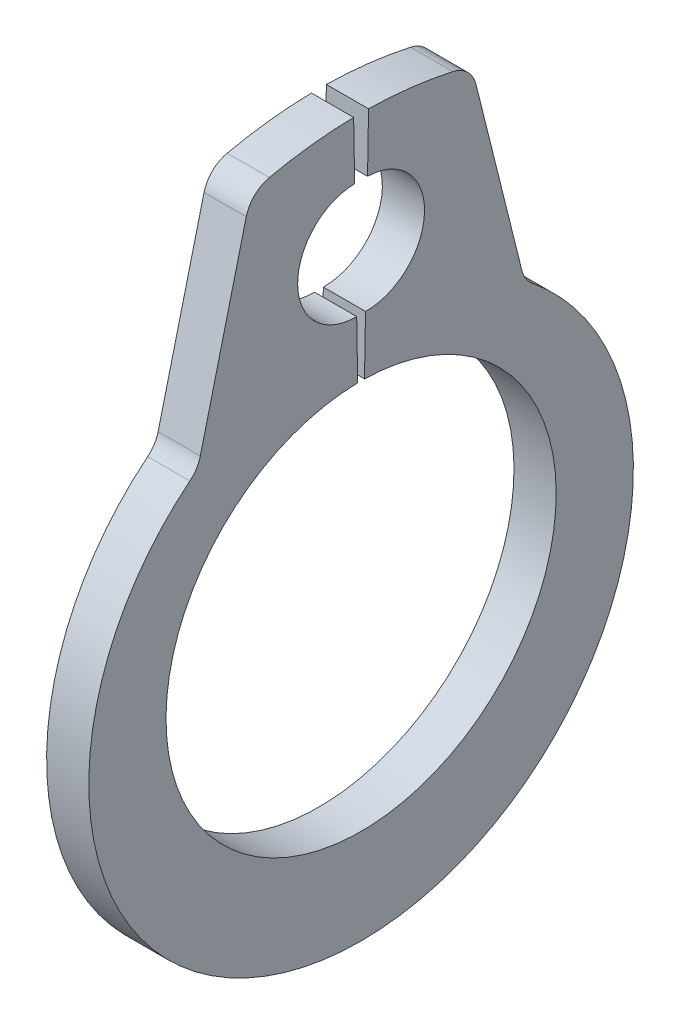
from build123d import *

# Parameters (mm, degrees)
EXTRUDE1_DEPTH = 0.2
FILLET1_R      = 0.29


with BuildPart() as part:
    # Sketch1 → Extrude1 (new, symmetric)
    with BuildSketch(Plane(origin=(0, 0, 0), x_dir=(0, 0, -1), z_dir=(1, 0, 0))):
        with BuildLine():
            Line((0.032286952, 1.849718236), (0.041885775, 2.399634468))
            ThreePointArc((0.041885775, 2.399634468), (0.601400831, 2.939951877), (0.061083423, 3.499466933))
            Line((0.061083423, 3.499466933), (0.070682246, 4.049383165))
            ThreePointArc((0.070682246, 4.049383165), (0.562907746, 4.010690074), (1.046766998, 3.912387871))
            Line((1.046766998, 3.912387871), (1.548955628, 1.898219287))
            ThreePointArc((1.548955628, 1.898219287), (0, -2.75), (-1.548955628, 1.898219287))
            Line((-1.548955628, 1.898219287), (-1.046766998, 3.912387871))
            ThreePointArc((-1.046766998, 3.912387871), (-0.562907746, 4.010690074), (-0.070682246, 4.049383165))
            Line((-0.070682246, 4.049383165), (-0.061083423, 3.499466933))
            ThreePointArc((-0.061083423, 3.499466933), (-0.601400831, 2.939951877), (-0.041885775, 2.399634468))
            Line((-0.041885775, 2.399634468), (-0.032286952, 1.849718236))
            ThreePointArc((-0.032286952, 1.849718236), (0, -1.85), (0.032286952, 1.849718236))
        make_face()
    extrude(amount=EXTRUDE1_DEPTH, both=True)

    # Fillet1
    fillet1_edges = [part.edges().sort_by_distance(p)[0] for p in [
        (0, 3.912387871, -1.046766998),
        (0, 1.898219287, -1.548955628),
        (0, 1.898219287, 1.548955628),
        (0, 3.912387871, 1.046766998),
    ]]
    fillet(fillet1_edges, radius=FILLET1_R)


solid = part.part
